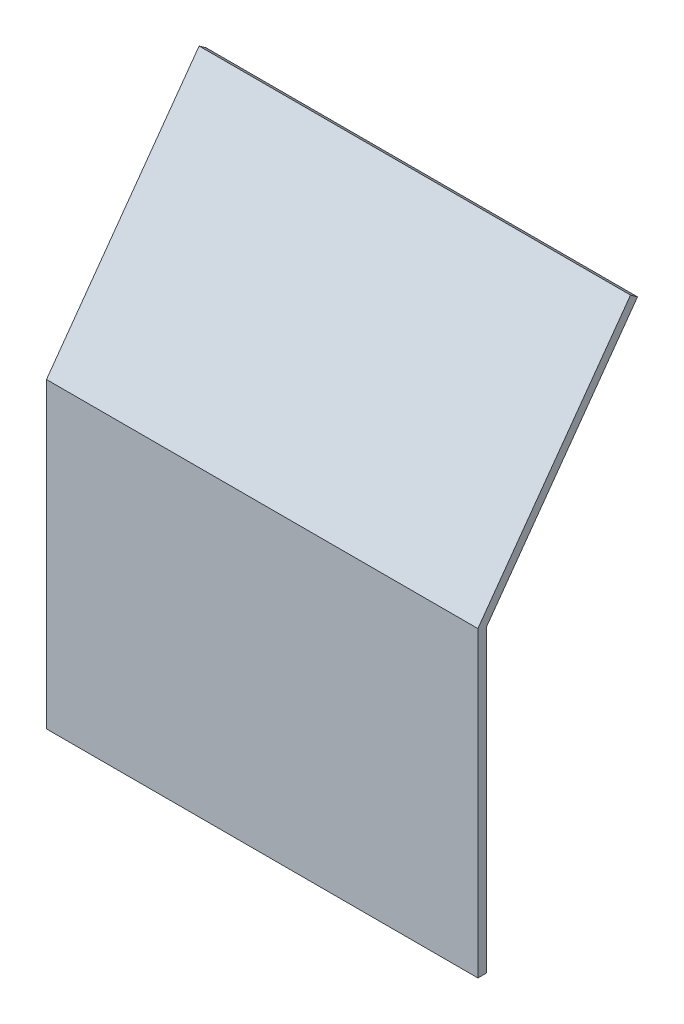
from build123d import *

# Parameters (mm, degrees)
BOSS_EXTRUDE1_DEPTH = 100


with BuildPart() as part:
    # Sketch1 → Boss-Extrude1 (new, symmetric)
    with BuildSketch(Plane(origin=(0, 0, 0), x_dir=(0, 0, -1), z_dir=(1, 0, 0))):
        Polygon((-4, 0), (-4, 140.287546089), (66.751068552, 238.801276781), (70, 236.467943448), (0, 139), (0, 0), align=None)
    extrude(amount=BOSS_EXTRUDE1_DEPTH, both=True)


solid = part.part
